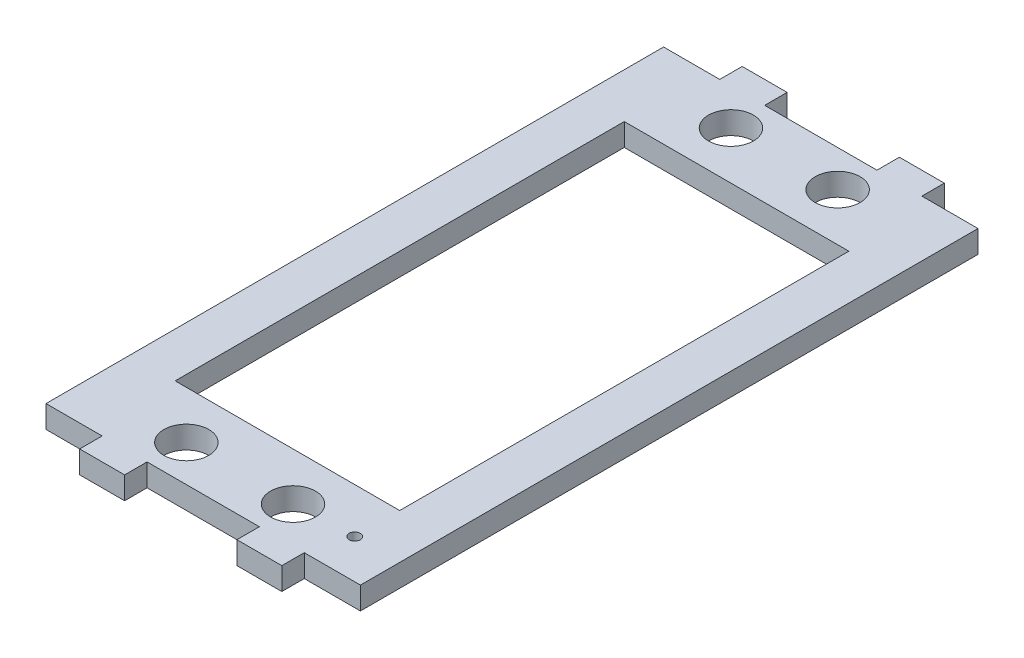
from build123d import *

# Parameters (mm, degrees)
SKETCH1_W           = 20
SKETCH1_H           = 40
BOSS_EXTRUDE1_DEPTH = 2
SKETCH2_R           = 2
SKETCH2_R_2         = 0.5
CUT_EXTRUDE1_DEPTH  = 2


with BuildPart() as part:
    # Sketch1 → Boss-Extrude1 (new body)
    with BuildSketch(Plane(origin=(0, 0, 0), x_dir=(1, 0, 0), z_dir=(0, 1, 0))):
        Polygon((-14, -27.5), (-9, -27.5), (-9, -29.5), (-5, -29.5), (-5, -27.5), (5, -27.5), (5, -29.5), (9, -29.5), (9, -27.5), (14, -27.5), (14, 27.5), (9, 27.5), (9, 29.5), (5, 29.5), (5, 27.5), (-5, 27.5), (-5, 29.5), (-9, 29.5), (-9, 27.5), (-14, 27.5), (-14, 14.5), (-14, -14.5), align=None)
        Rectangle(SKETCH1_W, SKETCH1_H, mode=Mode.SUBTRACT)
    extrude(amount=BOSS_EXTRUDE1_DEPTH)

    # Sketch2 → Cut-Extrude1 (cut)
    with BuildSketch(Plane(origin=(0, 2, 0), x_dir=(1, 0, 0), z_dir=(0, 1, 0))):
        with Locations(Location((4.75, 24.25, 0), (0, 0, 270))):
            Circle(SKETCH2_R)
        with Locations(Location((-4.75, 24.25, 0), (0, 0, 90))):
            Circle(SKETCH2_R)
        with Locations(Location((4.75, -24.25, 0), (0, 0, 270))):
            Circle(SKETCH2_R)
        with Locations(Location((-4.75, -24.25, 0), (0, 0, 90))):
            Circle(SKETCH2_R)
        with Locations(Location((10, -24.01, 0), (0, 0, 270))):
            Circle(SKETCH2_R_2)
    extrude(amount=-CUT_EXTRUDE1_DEPTH, mode=Mode.SUBTRACT)


solid = part.part
